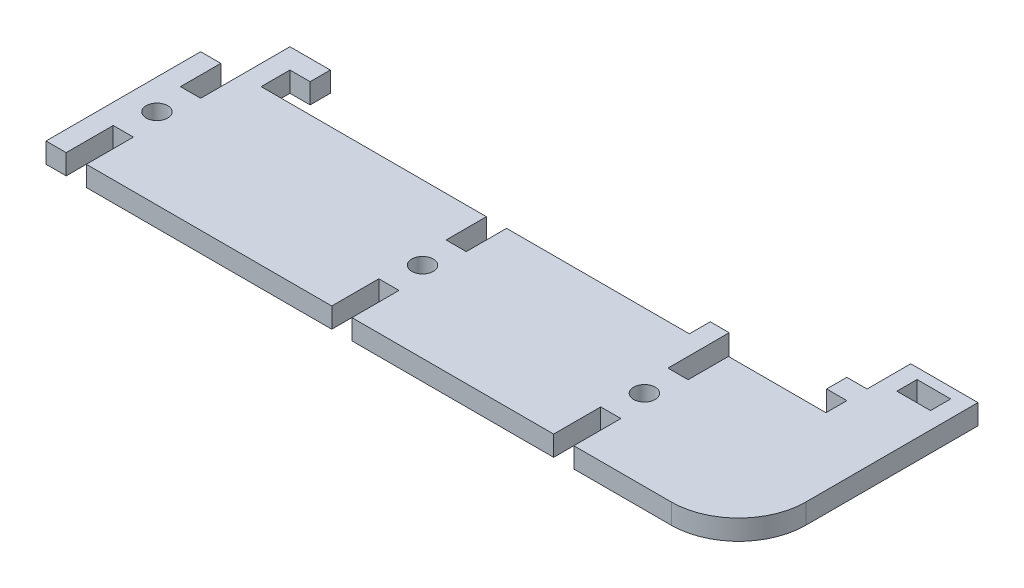
from build123d import *

# Parameters (mm, degrees)
SKETCH_1_R      = 1.6
SKETCH_1_W      = 5
SKETCH_1_H      = 3
EXTRUDE_3_DEPTH = 3


with BuildPart() as part:
    # 草图1 → 凸台-拉伸3 (new body)
    with BuildSketch(Plane(origin=(0, 0, 0), x_dir=(1, 0, 0), z_dir=(0, 1, 0))):
        with BuildLine():
            Line((-64.620407451, -23), (-64.620407451, 0))
            Line((-64.620407451, 0), (-61.620407451, 0))
            Line((-61.620407451, 0), (-61.620407451, -6))
            Line((-61.620407451, -6), (-58.620407451, -6))
            Line((-58.620407451, -6), (-58.620407451, 7.279592288))
            Line((-58.620407451, 7.279592288), (-52.620407451, 7.279592288))
            Line((-52.620407451, 7.279592288), (-52.620407451, 4.279592288))
            Line((-52.620407451, 4.279592288), (-55.620407451, 4.279592288))
            Line((-55.620407451, 4.279592288), (-55.620407451, 0))
            Line((-55.620407451, 0), (-22.120407451, 0))
            Line((-22.120407451, 0), (-22.120407451, -6))
            Line((-22.120407451, -6), (-19.120407451, -6))
            Line((-19.120407451, -6), (-19.120407451, 0))
            Line((-19.120407451, 0), (8.058394468, 0))
            Line((8.058394468, 0), (8.058394468, 3.112438553))
            Line((8.058394468, 3.112438553), (10.879592549, 3.112438553))
            Line((10.879592549, 3.112438553), (10.879592549, -6))
            Line((10.879592549, -6), (13.879592549, -6))
            Line((13.879592549, -6), (13.879592549, 0))
            Line((13.879592549, 0), (28.379592549, 0))
            Line((28.379592549, 0), (28.379592549, 3.112438553))
            Line((28.379592549, 3.112438553), (25.370412077, 3.112438553))
            Line((25.370412077, 3.112438553), (25.370412077, 6.112438553))
            Line((25.370412077, 6.112438553), (28.379592549, 6.112438553))
            Line((28.379592549, 6.112438553), (28.379592549, 12.612438553))
            Line((28.379592549, 12.612438553), (38.379592549, 12.612438553))
            Line((38.379592549, 12.612438553), (38.379592549, -13))
            ThreePointArc((38.379592549, -13), (35.450660361, -20.071067812), (28.379592549, -23))
            Line((28.379592549, -23), (13.879592549, -23))
            Line((13.879592549, -23), (13.879592549, -16))
            Line((13.879592549, -16), (10.879592549, -16))
            Line((10.879592549, -16), (10.879592549, -23))
            Line((10.879592549, -23), (-19.120407451, -23))
            Line((-19.120407451, -23), (-19.120407451, -16))
            Line((-19.120407451, -16), (-22.120407451, -16))
            Line((-22.120407451, -16), (-22.120407451, -23))
            Line((-22.120407451, -23), (-58.620407451, -23))
            Line((-58.620407451, -23), (-58.620407451, -16))
            Line((-58.620407451, -16), (-61.620407451, -16))
            Line((-61.620407451, -16), (-61.620407451, -23))
            Line((-61.620407451, -23), (-64.620407451, -23))
        make_face()
        with Locations(Location((-60.120407451, -11, 0), (0, 0, 270))):
            Circle(SKETCH_1_R, mode=Mode.SUBTRACT)
        with Locations(Location((-20.620407451, -11, 0), (0, 0, 270))):
            Circle(SKETCH_1_R, mode=Mode.SUBTRACT)
        with Locations(Location((12.379592549, -11, 0), (0, 0, 270))):
            Circle(SKETCH_1_R, mode=Mode.SUBTRACT)
        with Locations((33.379592549, 9.548629934)):
            Rectangle(SKETCH_1_W, SKETCH_1_H, mode=Mode.SUBTRACT)
    extrude(amount=-EXTRUDE_3_DEPTH)


solid = part.part
